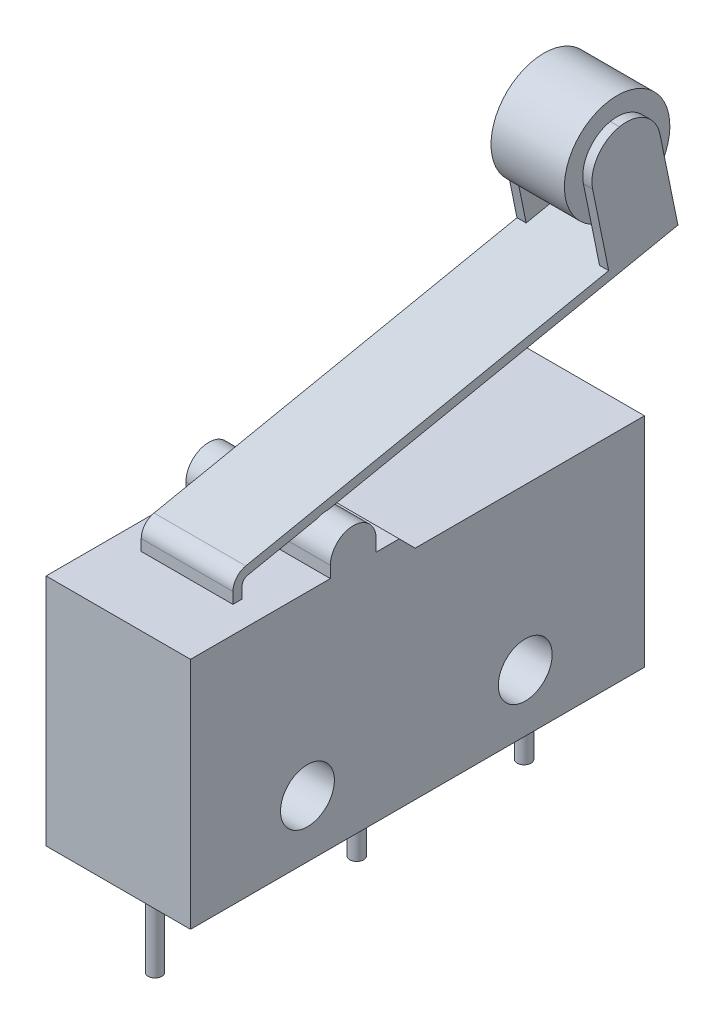
from build123d import *

# Parameters (mm, degrees)
ESQUISSE1_R      = 1.175
EXTRUSION1_DEPTH = 6.3
ESQUISSE2_R      = 0.3
EXTRUSION2_DEPTH = 4
ESQUISSE7_W      = 4
ESQUISSE7_H      = 0.4
ESQUISSE9_W      = 0.4
ESQUISSE9_H      = 3
EXTRUSION3_DEPTH = 5
CONG_1_R         = 1.499
ESQUISSE10_R     = 2.3
EXTRUSION4_DEPTH = 3.2


with BuildPart() as part:
    # Esquisse1 → Extrusion1 (new body)
    with BuildSketch(Plane(origin=(0, 0, 0), x_dir=(0, 0, -1), z_dir=(1, 0, 0))):
        with BuildLine():
            Line((9.8, 9.5), (19.8, 9.5))
            Line((19.8, 9.5), (19.8, 0))
            Line((19.8, 0), (0, 0))
            Line((0, 0), (0, 10.2))
            Line((0, 10.2), (6.1, 10.2))
            Line((6.1, 10.2), (6.1, 10.7))
            ThreePointArc((6.1, 10.7), (7.1, 11.7), (8.1, 10.7))
            Line((8.1, 10.7), (8.1, 10.2))
            Line((8.1, 10.2), (9.102549487, 10.2))
            Line((9.102549487, 10.2), (9.8, 9.5))
        make_face()
        with Locations((14.6, 2.5)):
            Circle(ESQUISSE1_R, mode=Mode.SUBTRACT)
        with Locations((5.1, 2.5)):
            Circle(ESQUISSE1_R, mode=Mode.SUBTRACT)
    extrude(amount=EXTRUSION1_DEPTH)

    # Esquisse2 → Extrusion2 (add)
    with BuildSketch(Plane.XZ):
        with Locations(Location((3.15, -1.6, 0), (0, 0, 90))):
            Circle(ESQUISSE2_R)
        with Locations(Location((3.15, -10.4, 0), (0, 0, 90))):
            Circle(ESQUISSE2_R)
        with Locations(Location((3.15, -17.7, 0), (0, 0, 90))):
            Circle(ESQUISSE2_R)
    extrude(amount=EXTRUSION2_DEPTH)

    # Balayage1: sweep along a path in Esquisse8
    with BuildLine(Plane(origin=(3.15, 0, 0), x_dir=(0, 0, -1), z_dir=(1, 0, 0))) as balayage1_path:
        Line((3.2, 10.2), (3.2, 10.687364871))
        ThreePointArc((3.2, 10.687364871), (3.312633707, 11.003509387), (3.59978942, 11.177219788))
        Line((3.59978942, 11.177219788), (22.368561812, 15.01678431))
    # Esquisse7 → Balayage1 (sweep)
    with BuildSketch(Plane(origin=(0, 10.2, 0), x_dir=(-1, 0, 0), z_dir=(0, 1, 0))):
        with Locations((-3.15, -3.2)):
            Rectangle(ESQUISSE7_W, ESQUISSE7_H)
    sweep(path=balayage1_path.line)

    # Esquisse9 → Extrusion3 (add)
    with BuildSketch(Plane(origin=(0, 10.217352882, 2.090183887), x_dir=(-1, 0, 0), z_dir=(0, 0.979709834039956, 0.20042115927566628))):
        with Locations((-4.95, -23.4243813)):
            Rectangle(ESQUISSE9_W, ESQUISSE9_H)
        with Locations((-1.35, -23.4243813)):
            Rectangle(ESQUISSE9_W, ESQUISSE9_H)
    extrude(amount=EXTRUSION3_DEPTH)

    # Congé1
    cong_1_edges = [part.edges().sort_by_distance(p)[0] for p in [
        (1.35, 19.510011969, -18.387242281),
        (1.35, 20.111275447, -21.326371784),
        (4.95, 20.111275447, -21.326371784),
        (4.95, 19.510011969, -18.387242281),
    ]]
    fillet(cong_1_edges, radius=CONG_1_R)

    # Esquisse10 → Extrusion4 (add)
    with BuildSketch(Plane(origin=(1.55, 0, 0), x_dir=(0, 0, -1), z_dir=(1, 0, 0))):
        with Locations(Location((20.15723835, 18.342058667, 0), (0, 0, 240.855881524))):
            Circle(ESQUISSE10_R)
    extrude(amount=EXTRUSION4_DEPTH)


solid = part.part
